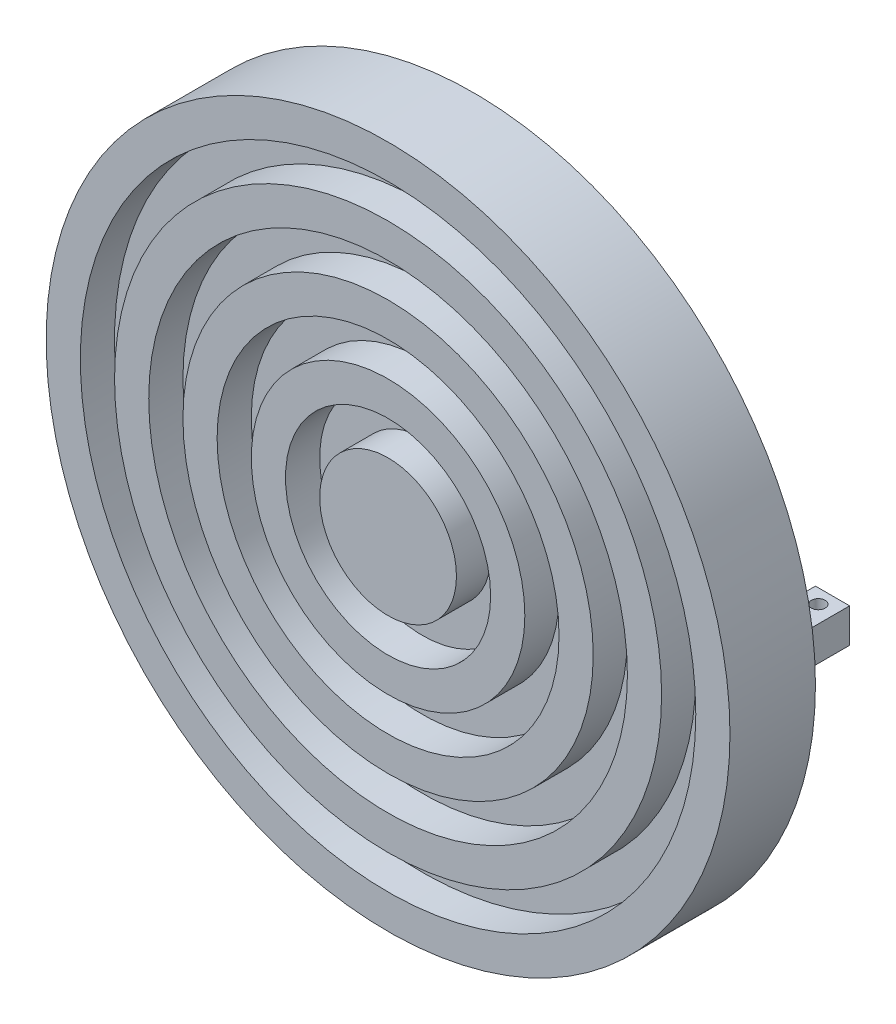
from build123d import *

# Parameters (mm, degrees)
SKETCH1_R           = 10
BOSS_EXTRUDE1_DEPTH = 2.5
SKETCH5_W           = 1
SKETCH5_H           = 1
SKETCH6_W           = 1
SKETCH6_H           = 2
BOSS_EXTRUDE2_DEPTH = 0.5
SKETCH7_R           = 0.2
CUT_EXTRUDE1_DEPTH  = 1.5


with BuildPart() as part:
    # Sketch1 → Boss-Extrude1 (new body)
    with BuildSketch(Plane(origin=(0, 0, 0), x_dir=(0, 1, 0), z_dir=(0, 0, 1))):
        with Locations(Location((0, 0, 0), (0, 0, 270))):
            Circle(SKETCH1_R)
    extrude(amount=BOSS_EXTRUDE1_DEPTH)

    # Sketch5 → Cut-Revolve1 (revolve, cut)
    with BuildSketch(Plane(origin=(0, 0, 0), x_dir=(-1, 0, 0), z_dir=(0, 1, 0))):
        with Locations((-4.5, 2)):
            Rectangle(SKETCH5_W, SKETCH5_H)
        with Locations((-2.5, 2)):
            Rectangle(SKETCH5_W, SKETCH5_H)
        with Locations((-6.5, 2)):
            Rectangle(SKETCH5_W, SKETCH5_H)
        with Locations((-8.5, 2)):
            Rectangle(SKETCH5_W, SKETCH5_H)
    revolve(axis=Axis((0, 0, 2.5), (0, 0, -1)), mode=Mode.SUBTRACT)

    # Sketch6 → Boss-Extrude2 (add, symmetric)
    with BuildSketch(Plane(origin=(0, 0, 0), x_dir=(-1, 0, 0), z_dir=(0, 1, 0))):
        with Locations((-2.5, -1)):
            Rectangle(SKETCH6_W, SKETCH6_H)
        with Locations((-4.5, -1)):
            Rectangle(SKETCH6_W, SKETCH6_H)
        with Locations((-6.5, -1)):
            Rectangle(SKETCH6_W, SKETCH6_H)
        with Locations((-8.5, -1)):
            Rectangle(SKETCH6_W, SKETCH6_H)
    extrude(amount=BOSS_EXTRUDE2_DEPTH, both=True)

    # Sketch7 → Cut-Extrude1 (cut, symmetric)
    with BuildSketch(Plane(origin=(0, 0, 0), x_dir=(-1, 0, 0), z_dir=(0, 1, 0))):
        with Locations(Location((-8.5, -1.583373246, 0), (0, 0, 90))):
            Circle(SKETCH7_R)
        with Locations(Location((-6.5, -1.583373246, 0), (0, 0, 90))):
            Circle(SKETCH7_R)
        with Locations(Location((-4.5, -1.583373246, 0), (0, 0, 90))):
            Circle(SKETCH7_R)
        with Locations(Location((-2.5, -1.583373246, 0), (0, 0, 270))):
            Circle(SKETCH7_R)
    extrude(amount=CUT_EXTRUDE1_DEPTH, both=True, mode=Mode.SUBTRACT)


solid = part.part
